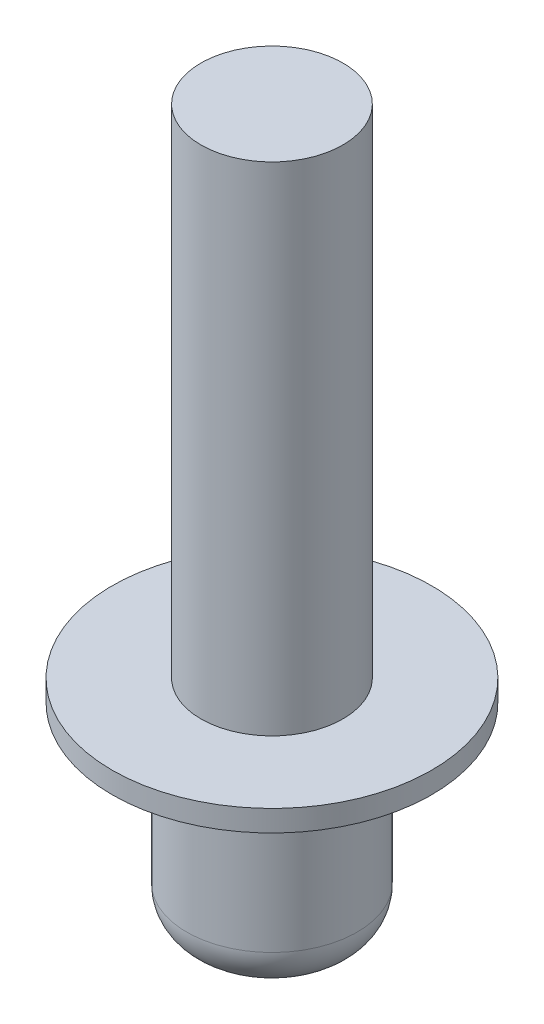
from build123d import *

# Parameters (mm, degrees)
SKETCH1_R           = 22.5
BOSS_EXTRUDE3_DEPTH = 3
SKETCH2_R           = 10
BOSS_EXTRUDE5_DEPTH = 70
SKETCH5_R           = 12
BOSS_EXTRUDE6_DEPTH = 28
FILLET1_R           = 6


with BuildPart() as part:
    # Sketch1 → Boss-Extrude3 (new body)
    with BuildSketch(Plane(origin=(0, 0, 0), x_dir=(1, 0, 0), z_dir=(0, 1, 0))):
        with Locations(Location((0, 0, 0), (0, 0, 270))):
            Circle(SKETCH1_R)
    extrude(amount=BOSS_EXTRUDE3_DEPTH)

    # Sketch2 → Boss-Extrude5 (add)
    with BuildSketch(Plane(origin=(0, 3, 0), x_dir=(1, 0, 0), z_dir=(0, 1, 0))):
        with Locations(Location((0, 0, 0), (0, 0, 270))):
            Circle(SKETCH2_R)
    extrude(amount=BOSS_EXTRUDE5_DEPTH)

    # Sketch5 → Boss-Extrude6 (add)
    with BuildSketch(Plane.XZ):
        with Locations(Location((0, 0, 0), (0, 0, 270))):
            Circle(SKETCH5_R)
    extrude(amount=BOSS_EXTRUDE6_DEPTH)

    # Fillet1
    fillet1_edges = [part.edges().sort_by_distance(p)[0] for p in [
        (0, -28, 12),
    ]]
    fillet(fillet1_edges, radius=FILLET1_R)


solid = part.part
